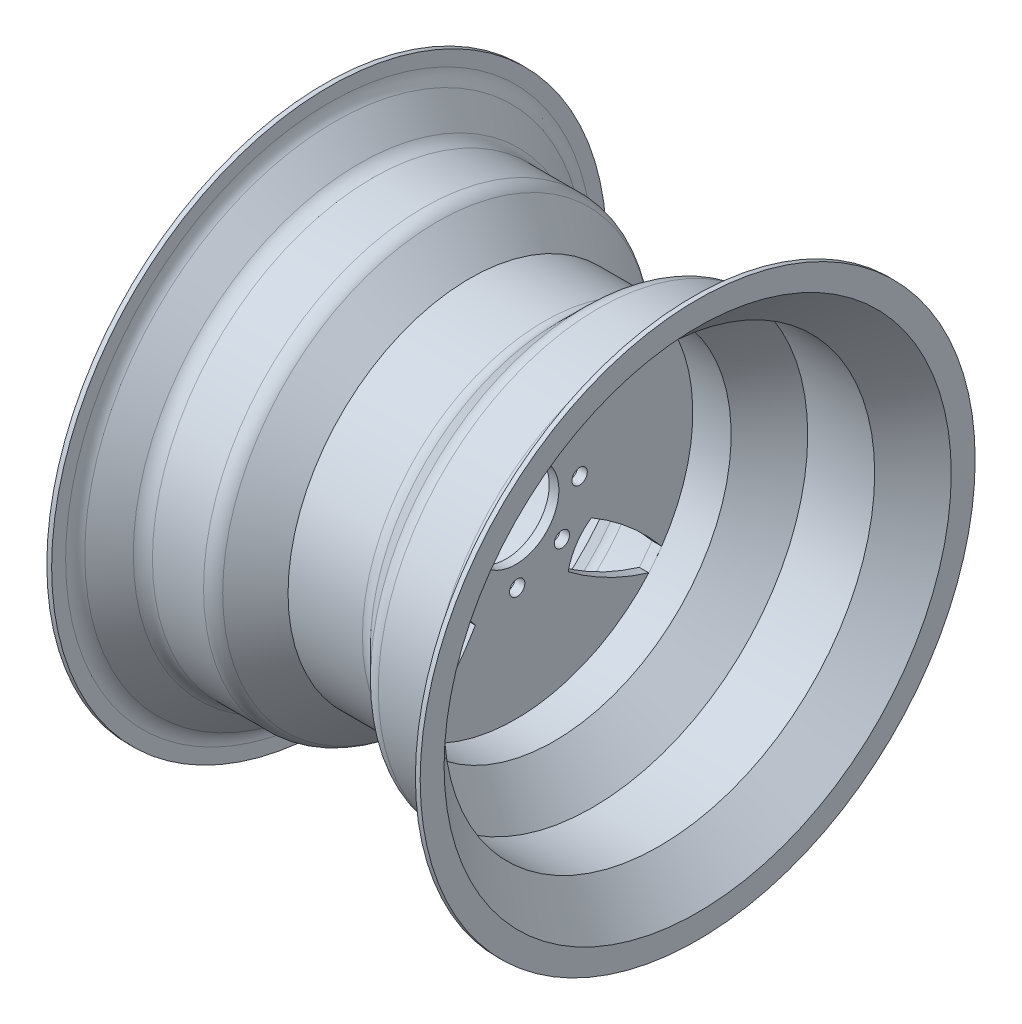
from build123d import *

# Parameters (mm, degrees)
FILLET1_R          = 20
CUT_EXTRUDE2_DEPTH = 457.321323385
SKETCH3_R          = 8
CUT_EXTRUDE3_DEPTH = 457.321323385


with BuildPart() as part:
    # Sketch1 → Revolve1 (revolve)
    with BuildSketch(Plane.XY, mode=Mode.PRIVATE) as revolve1_sk:
        Polygon((-195.072862168, 290), (-195.072862168, 265), (-155.072862168, 225), (-85.072862168, 225), (-45.072862168, 185), (-5, 185), (-5, 45), (5, 45), (5, 185), (45.072862168, 185), (85.072862168, 225), (155.072862168, 225), (195.072862168, 265), (195.072862168, 290), (190.072862168, 290), (190.072862168, 267.071067812), (153.001794357, 230), (83.001794357, 230), (43.001794357, 190), (-43.001794357, 190), (-83.001794357, 230), (-153.001794357, 230), (-190.072862168, 267.071067812), (-190.072862168, 290), align=None)
    revolve(revolve1_sk.sketch.rotate(Axis((-343.890956764, 0, 0), (1, 0, 0)), 90), axis=Axis((-343.890956764, 0, 0), (1, 0, 0)))

    # Fillet1
    fillet1_edges = [part.edges().sort_by_distance(p)[0] for p in [
        (-45.072862168, 0, -185),
        (190.072862168, 0, -267.071067812),
        (153.001794357, 0, -230),
        (83.001794357, 0, -230),
        (43.001794357, 0, -190),
        (-83.001794357, 0, -230),
        (-153.001794357, 0, -230),
        (-190.072862168, 0, -267.071067812),
    ]]
    fillet(fillet1_edges, radius=FILLET1_R)

    # Sketch2 → Cut-Extrude2 (cut, through all)
    with BuildSketch(Plane.ZY.offset(5)):
        with BuildLine():
            ThreePointArc((54.746234537, 78.898985068), (63.340782984, 58.256658031), (78.898985068, 42.196948305))
            ThreePointArc((78.898985068, 42.196948305), (118.409461693, 70.28217645), (152.471542273, 104.773225573))
            ThreePointArc((152.471542273, 104.773225573), (145.883511032, 113.530508797), (139.012571213, 122.067624884))
            ThreePointArc((139.012571213, 122.067624884), (94.965904289, 104.218505269), (54.746234537, 78.898985068))
        make_face()
        with BuildLine():
            ThreePointArc((42.196948305, -78.898985068), (70.28217645, -118.409461693), (104.773225573, -152.471542273))
            ThreePointArc((104.773225573, -152.471542273), (113.530508797, -145.883511032), (122.067624884, -139.012571213))
            ThreePointArc((122.067624884, -139.012571213), (104.218505269, -94.965904289), (78.898985068, -54.746234537))
            ThreePointArc((78.898985068, -54.746234537), (58.256658031, -63.340782984), (42.196948305, -78.898985068))
        make_face()
        with BuildLine():
            ThreePointArc((-78.898985068, -42.196948305), (-118.409461693, -70.28217645), (-152.471542273, -104.773225573))
            ThreePointArc((-152.471542273, -104.773225573), (-145.883511032, -113.530508797), (-139.012571213, -122.067624884))
            ThreePointArc((-139.012571213, -122.067624884), (-94.965904289, -104.218505269), (-54.746234537, -78.898985068))
            ThreePointArc((-54.746234537, -78.898985068), (-63.340782984, -58.256658031), (-78.898985068, -42.196948305))
        make_face()
        with BuildLine():
            ThreePointArc((-42.196948305, 78.898985068), (-70.28217645, 118.409461693), (-104.773225573, 152.471542273))
            ThreePointArc((-104.773225573, 152.471542273), (-113.530508797, 145.883511032), (-122.067624884, 139.012571213))
            ThreePointArc((-122.067624884, 139.012571213), (-104.218505269, 94.965904289), (-78.898985068, 54.746234537))
            ThreePointArc((-78.898985068, 54.746234537), (-58.256658031, 63.340782984), (-42.196948305, 78.898985068))
        make_face()
    extrude(amount=-CUT_EXTRUDE2_DEPTH, mode=Mode.SUBTRACT)

    # Sketch3 → Cut-Extrude3 (cut, through all)
    with BuildSketch(Plane.ZY.offset(5)):
        with Locations((1.464466094, 66.735231129)):
            Circle(SKETCH3_R)
        with Locations((48.224468381, 46.153400569)):
            Circle(SKETCH3_R)
        with Locations((66.735231129, -1.464466094)):
            Circle(SKETCH3_R)
        with Locations((46.153400569, -48.224468381)):
            Circle(SKETCH3_R)
        with Locations((-1.464466094, -66.735231129)):
            Circle(SKETCH3_R)
        with Locations((-48.224468381, -46.153400569)):
            Circle(SKETCH3_R)
        with Locations((-66.735231129, 1.464466094)):
            Circle(SKETCH3_R)
        with Locations((-46.153400569, 48.224468381)):
            Circle(SKETCH3_R)
    extrude(amount=-CUT_EXTRUDE3_DEPTH, mode=Mode.SUBTRACT)


solid = part.part
